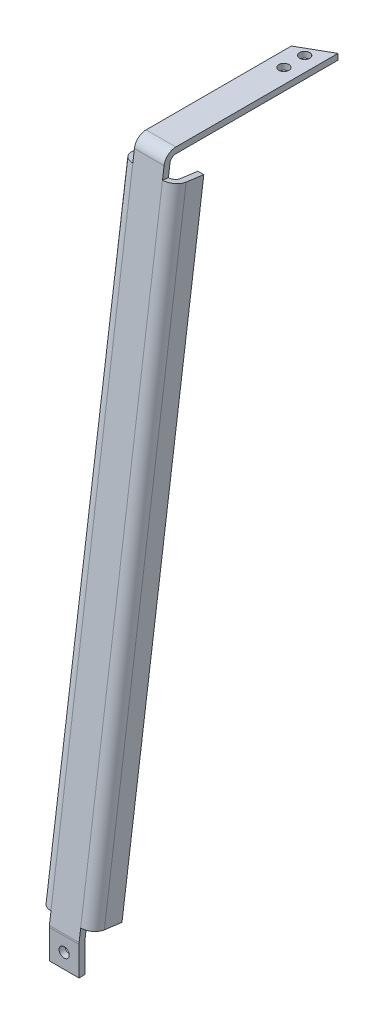
from build123d import *

# Parameters (mm, degrees)
FORMED_WEB_DEPTH           = 10
EDGE_STIFFENING_LIPS_DEPTH = 206.123068282
WALL_MOUNT_HOLE_SKETCH_R   = 1.7
WALL_MOUNT_HOLES_DEPTH     = 2.4
COVER_MOUNT_HOLE_SKETCH_R  = 1.7
COVER_MOUNT_HOLE_DEPTH     = 2.4
LOWER_EDGE_CLEARANCE_DEPTH = 2.4


with BuildPart() as part:
    # Formed Web Section Sketch → Formed Web (new body)
    with BuildSketch(Plane(origin=(-260, 0, 0), x_dir=(0, 0, -1), z_dir=(1, 0, 0))):
        with BuildLine():
            Line((-22, -64), (-77.377483747, -64))
            ThreePointArc((-77.377483747, -64), (-80.010089753, -64.988457933), (-81.341585612, -67.46530719))
            Line((-81.341585612, -67.46530719), (-109.964101865, -279.66672079))
            ThreePointArc((-109.964101865, -279.66672079), (-109.991015376, -279.933465342), (-110, -280.2014136))
            Line((-110, -280.2014136), (-110, -290))
            Line((-110, -290), (-108, -290))
            Line((-108, -290), (-108, -280.2014136))
            ThreePointArc((-108, -280.2014136), (-107.995507688, -280.067439471), (-107.982050933, -279.934067195))
            Line((-107.982050933, -279.934067195), (-79.35953468, -67.732653595))
            ThreePointArc((-79.35953468, -67.732653595), (-78.69378675, -66.494228967), (-77.377483747, -66))
            Line((-77.377483747, -66), (-22, -66))
            Line((-22, -66), (-22, -64))
        make_face()
    extrude(amount=FORMED_WEB_DEPTH)

    # Edge Lip Sketch → Edge Stiffening Lips (add)
    with BuildSketch(Plane(origin=(0, -80.999511953, 10.925515566), x_dir=(-1, 0, 0), z_dir=(0, -0.9910254663478989, 0.1336732024376229))):
        with BuildLine():
            Line((264, -67.593279149), (264, -61.593279149))
            Line((264, -61.593279149), (262, -61.593279149))
            Line((262, -61.593279149), (262, -67.593279149))
            ThreePointArc((262, -67.593279149), (261.414213562, -69.007492712), (260, -69.593279149))
            Line((260, -69.593279149), (259.9, -69.593279149))
            Line((259.9, -69.593279149), (259.9, -71.593279149))
            Line((259.9, -71.593279149), (260, -71.593279149))
            ThreePointArc((260, -71.593279149), (262.828427125, -70.421706274), (264, -67.593279149))
        make_face()
        with BuildLine():
            Line((246, -67.593279149), (246, -61.593279149))
            Line((246, -61.593279149), (248, -61.593279149))
            Line((248, -61.593279149), (248, -67.593279149))
            ThreePointArc((248, -67.593279149), (248.585786438, -69.007492712), (250, -69.593279149))
            Line((250, -69.593279149), (250.1, -69.593279149))
            Line((250.1, -69.593279149), (250.1, -71.593279149))
            Line((250.1, -71.593279149), (250, -71.593279149))
            ThreePointArc((250, -71.593279149), (247.171572875, -70.421706274), (246, -67.593279149))
        make_face()
    extrude(amount=EDGE_STIFFENING_LIPS_DEPTH)

    # Wall Mount Hole Sketch → Wall Mount Holes (cut)
    with BuildSketch(Plane(origin=(0, -63.8, 0), x_dir=(-1, 0, 0), z_dir=(0, -1, 0))):
        with Locations(Location((255, -29, 0), (0, 0, 270))):
            Circle(WALL_MOUNT_HOLE_SKETCH_R)
        with Locations(Location((255, -36, 0), (0, 0, 270))):
            Circle(WALL_MOUNT_HOLE_SKETCH_R)
    extrude(amount=WALL_MOUNT_HOLES_DEPTH, mode=Mode.SUBTRACT)

    # Cover Mount Hole Sketch → Cover Mount Hole (cut)
    with BuildSketch(Plane.XY.offset(107.8)):
        with Locations(Location((-255, -285, 0), (0, 0, 90))):
            Circle(COVER_MOUNT_HOLE_SKETCH_R)
    extrude(amount=COVER_MOUNT_HOLE_DEPTH, mode=Mode.SUBTRACT)

    # Lower Edge Clearance Sketch → Lower Edge Clearance (cut)
    with BuildSketch(Plane(origin=(0, -63.8, 0), x_dir=(-1, 0, 0), z_dir=(0, -1, 0))):
        Polygon((261, -20), (249, -20), (249, -22.23), (261, -29.07), align=None)
    extrude(amount=LOWER_EDGE_CLEARANCE_DEPTH, mode=Mode.SUBTRACT)


solid = part.part
